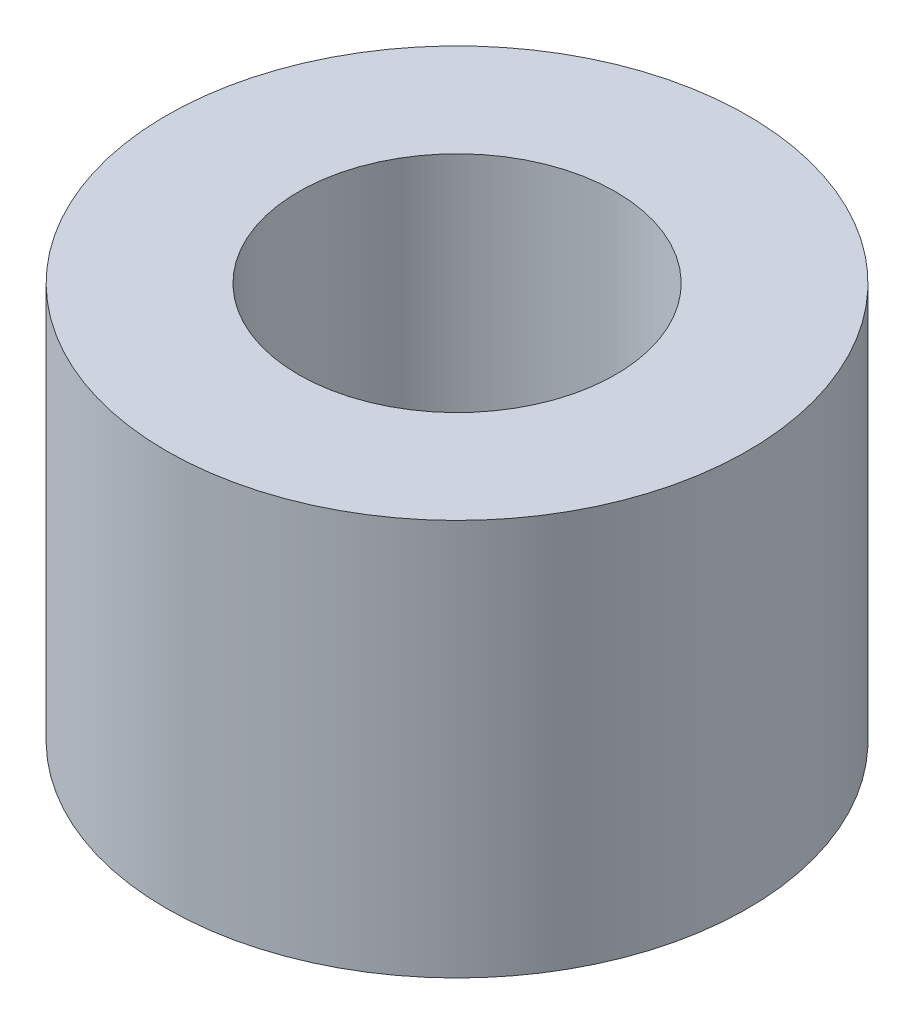
from build123d import *

# Parameters (mm, degrees)
SKETCH1_R           = 11
SKETCH1_R_2         = 6
BOSS_EXTRUDE1_DEPTH = 15


with BuildPart() as part:
    # Sketch1 → Boss-Extrude1 (new body)
    with BuildSketch(Plane(origin=(0, 0, 0), x_dir=(1, 0, 0), z_dir=(0, 1, 0))):
        with Locations(Location((0, 0, 0), (0, 0, 270))):
            Circle(SKETCH1_R)
        with Locations(Location((0, 0, 0), (0, 0, 270))):
            Circle(SKETCH1_R_2, mode=Mode.SUBTRACT)
    extrude(amount=BOSS_EXTRUDE1_DEPTH)


solid = part.part
